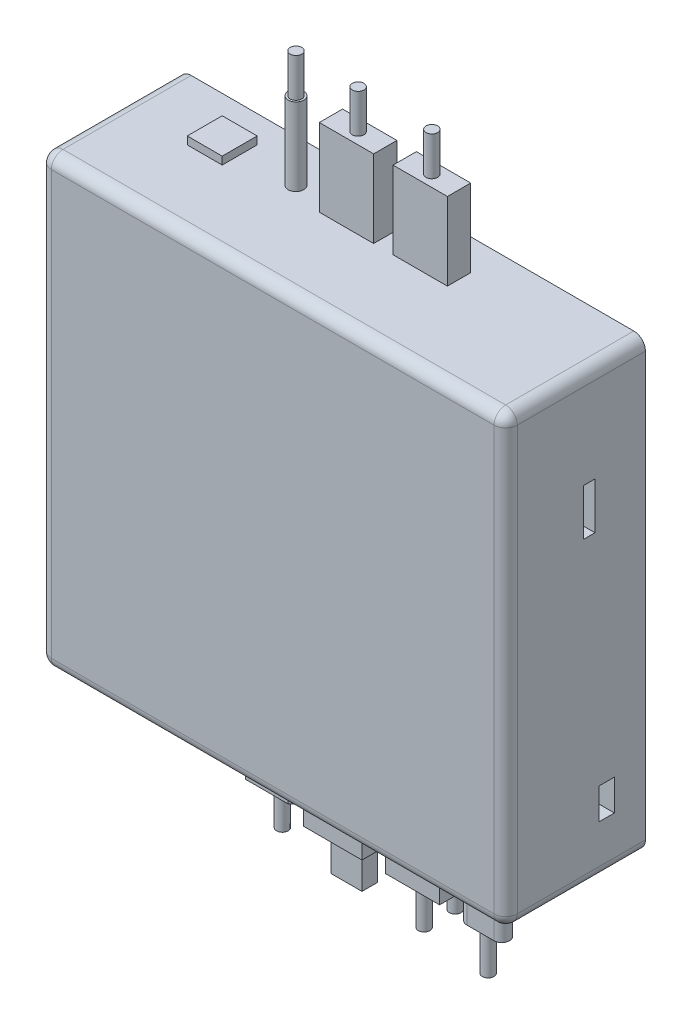
from build123d import *

# Parameters (mm, degrees)
SKETCH_1_W          = 120
SKETCH_1_H          = 115
EXTRUDE_1_DEPTH     = 36
SKETCH_2_R          = 1.5
CUT_EXTRUDE_1_DEPTH = 6
FILLET_1_R          = 3
SKETCH_3_R          = 3.5
SKETCH_3_W          = 14
SKETCH_3_H          = 6
EXTRUDE_2_DEPTH     = 20
SKETCH_4_R          = 1.5
SKETCH_4_W          = 8
SKETCH_4_H          = 4
EXTRUDE_3_DEPTH     = 10
SKETCH_5_W          = 3
SKETCH_5_H          = 12
SKETCH_5_W_2        = 4
SKETCH_5_H_2        = 8
CUT_EXTRUDE_2_DEPTH = 10
SKETCH_6_W          = 9
SKETCH_6_H          = 9
EXTRUDE_4_DEPTH     = 2
SKETCH_7_R          = 2
EXTRUDE_5_DEPTH     = 20
SKETCH_7_W          = 14
SKETCH_7_H          = 6
EXTRUDE_5_2_DEPTH   = 20
EXTRUDE_5_3_DEPTH   = 20
SKETCH_9_R          = 1.5
EXTRUDE_6_DEPTH     = 10
SKETCH_10_W         = 116
SKETCH_10_H         = 111
SKETCH_10_R         = 5
SKETCH_10_R_2       = 1.5
CUT_EXTRUDE_3_DEPTH = 5


with BuildPart() as part:
    # 草图1 → 凸台-拉伸1 (new body)
    with BuildSketch(Plane.XY):
        Rectangle(SKETCH_1_W, SKETCH_1_H)
    extrude(amount=EXTRUDE_1_DEPTH)

    # 草图2 → 切除-拉伸1 (cut)
    with BuildSketch(Plane(origin=(0, 0, 0), x_dir=(-1, 0, 0), z_dir=(0, 0, -1))):
        with Locations((0, 42)):
            Circle(SKETCH_2_R)
        with Locations((0, -42)):
            Circle(SKETCH_2_R)
    extrude(amount=-CUT_EXTRUDE_1_DEPTH, mode=Mode.SUBTRACT)

    # 圆角1
    fillet_1_edges = [part.edges().sort_by_distance(p)[0] for p in [
        (60, 0, 36),
        (0, 57.5, 36),
        (-60, 0, 36),
        (0, -57.5, 36),
        (-60, 57.5, 18),
        (60, 57.5, 18),
        (60, -57.5, 18),
        (-60, -57.5, 18),
    ]]
    fillet(fillet_1_edges, radius=FILLET_1_R)

    # 草图3 → 凸台-拉伸2 (add)
    with BuildSketch(Plane.XZ.offset(57.5)):
        with Locations(Location((-40, 10, 0), (0, 0, 180))):
            Circle(SKETCH_3_R)
        Polygon((-30, 13), (-28, 15), (-17, 15), (-15, 13), (-15, 8), (-30, 8), align=None)
        Polygon((0, 8), (5, 8), (5, 18), (-10, 18), (-10, 8), (-5, 8), (-5, 6.5), (0, 6.5), align=None)
        with Locations((18, 15)):
            Rectangle(SKETCH_3_W, SKETCH_3_H)
        with Locations((18, 7)):
            Rectangle(SKETCH_3_W, SKETCH_3_H)
        with BuildLine():
            Line((33, 19), (40, 19))
            ThreePointArc((40, 19), (42, 17), (40, 15))
            Line((40, 15), (33, 15))
            ThreePointArc((33, 15), (31, 17), (33, 19))
        make_face()
    extrude(amount=EXTRUDE_2_DEPTH)

    # 草图4 → 凸台-拉伸3 (add)
    with BuildSketch(Plane.XZ.offset(77.5)):
        with Locations(Location((-22.5, 11, 0), (0, 0, 270))):
            Circle(SKETCH_4_R)
        with Locations(Location((18, 15, 0), (0, 0, 270))):
            Circle(SKETCH_4_R)
        with Locations(Location((18, 7, 0), (0, 0, 270))):
            Circle(SKETCH_4_R)
        with Locations(Location((36.5, 17, 0), (0, 0, 270))):
            Circle(SKETCH_4_R)
        with Locations((-2, 13)):
            Rectangle(SKETCH_4_W, SKETCH_4_H)
    extrude(amount=EXTRUDE_3_DEPTH)

    # 草图5 → 切除-拉伸2 (cut)
    with BuildSketch(Plane(origin=(60, 0, 0), x_dir=(0, 0, -1), z_dir=(1, 0, 0))):
        with Locations((-14.5, 26.5)):
            Rectangle(SKETCH_5_W, SKETCH_5_H)
        with Locations((-10, -40.5)):
            Rectangle(SKETCH_5_W_2, SKETCH_5_H_2)
    extrude(amount=-CUT_EXTRUDE_2_DEPTH, mode=Mode.SUBTRACT)

    # 草图6 → 凸台-拉伸4 (add)
    with BuildSketch(Plane(origin=(0, 57.5, 0), x_dir=(1, 0, 0), z_dir=(0, 1, 0))):
        with Locations((-37.5, -11.5)):
            Rectangle(SKETCH_6_W, SKETCH_6_H)
    extrude(amount=EXTRUDE_4_DEPTH)

    # 草图10 → 切除-拉伸3 (cut)
    with BuildSketch(Plane(origin=(0, 0, 0), x_dir=(-1, 0, 0), z_dir=(0, 0, -1))):
        Rectangle(SKETCH_10_W, SKETCH_10_H)
        with Locations((50, -47.5)):
            Circle(SKETCH_10_R, mode=Mode.SUBTRACT)
        with Locations((-50, -47.5)):
            Circle(SKETCH_10_R, mode=Mode.SUBTRACT)
        with Locations((50, 47.5)):
            Circle(SKETCH_10_R, mode=Mode.SUBTRACT)
        with Locations((-50, 47.5)):
            Circle(SKETCH_10_R, mode=Mode.SUBTRACT)
        with Locations((0, -42)):
            Circle(SKETCH_10_R_2, mode=Mode.SUBTRACT)
        with Locations((0, 42)):
            Circle(SKETCH_10_R_2, mode=Mode.SUBTRACT)
    extrude(amount=-CUT_EXTRUDE_3_DEPTH, mode=Mode.SUBTRACT)


with BuildPart() as body_2:
    # 草图7 → 凸台-拉伸5 (new body)
    with BuildSketch(Plane(origin=(0, 57.5, 0), x_dir=(1, 0, 0), z_dir=(0, 1, 0))):
        with Locations(Location((-19, -11, 0), (0, 0, 180))):
            Circle(SKETCH_7_R)
    extrude(amount=EXTRUDE_5_DEPTH)



with BuildPart() as body_3:
    # 草图7 → Extrude 5 2 (new body)
    with BuildSketch(Plane(origin=(0, 57.5, 0), x_dir=(1, 0, 0), z_dir=(0, 1, 0))):
        with Locations((-3, -11)):
            Rectangle(SKETCH_7_W, SKETCH_7_H)
    extrude(amount=EXTRUDE_5_2_DEPTH)


with BuildPart() as body_4:
    # 草图7 → Extrude 5 3 (new body)
    with BuildSketch(Plane(origin=(0, 57.5, 0), x_dir=(1, 0, 0), z_dir=(0, 1, 0))):
        with Locations((16, -11)):
            Rectangle(SKETCH_7_W, SKETCH_7_H)
    extrude(amount=EXTRUDE_5_3_DEPTH)


with BuildPart() as body_2_1:
    add(body_2.part)

    add(body_3.part)  # 凸台-拉伸6 merges body 3

    add(body_4.part)  # 凸台-拉伸6 merges body 4
    # 草图9 → 凸台-拉伸6 (add)
    with BuildSketch(Plane(origin=(0, 77.5, 0), x_dir=(1, 0, 0), z_dir=(0, 1, 0))):
        with Locations(Location((-3, -11, 0), (0, 0, 270))):
            Circle(SKETCH_9_R)
        with Locations(Location((16, -11, 0), (0, 0, 270))):
            Circle(SKETCH_9_R)
        with Locations(Location((-19, -11, 0), (0, 0, 270))):
            Circle(SKETCH_9_R)
    extrude(amount=EXTRUDE_6_DEPTH)


solid = Compound([part.part, body_2_1.part])
